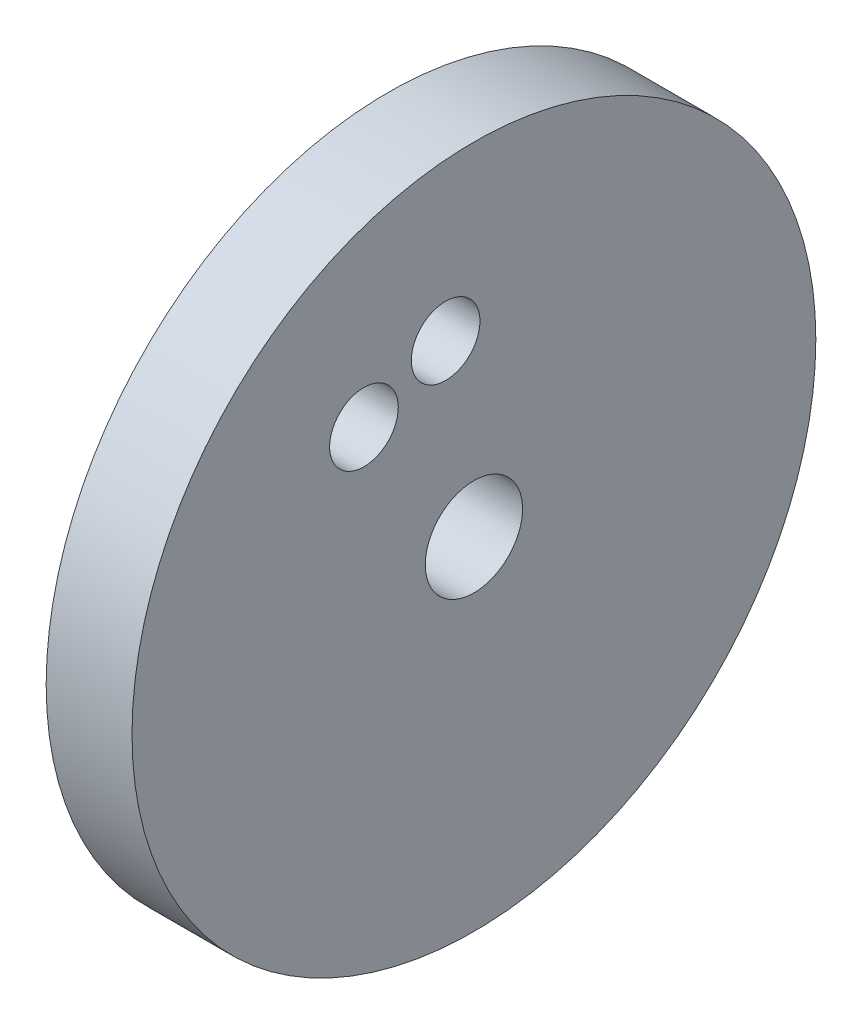
from build123d import *

# Parameters (mm, degrees)
AXIAL_PROFILE_MM_W     = 6
AXIAL_PROFILE_MM_H     = 20.5
AXIAL_HOLES_DEPTH      = 86.926829338
AXIAL_HOLES_DEPTH_BACK = 86.926829338
SKETCH2_R              = 2.4


with BuildPart() as part:
    # Axial profile (mm) → Full revolution (revolve)
    with BuildSketch(Plane.XY, mode=Mode.PRIVATE) as full_revolution_sk:
        with Locations((76, 13.65)):
            Rectangle(AXIAL_PROFILE_MM_W, AXIAL_PROFILE_MM_H)
    revolve(full_revolution_sk.sketch.rotate(Axis((-110, 0, 0), (1, 0, 0)), 90), axis=Axis((-110, 0, 0), (1, 0, 0)))

    # Sketch2 → Axial holes (cut, two sides: drawn at the far end of the back side and taken through both)
    with BuildSketch(Plane(origin=(0, 0, 0), x_dir=(0, 0, -1), z_dir=(1, 0, 0)).offset(-AXIAL_HOLES_DEPTH_BACK)):
        with Locations((-1.977382665, 12.848733704)):
            Circle(SKETCH2_R)
        with Locations((-7.687206041, 10.483647423)):
            Circle(SKETCH2_R)
    extrude(amount=AXIAL_HOLES_DEPTH + AXIAL_HOLES_DEPTH_BACK, mode=Mode.SUBTRACT)


solid = part.part
